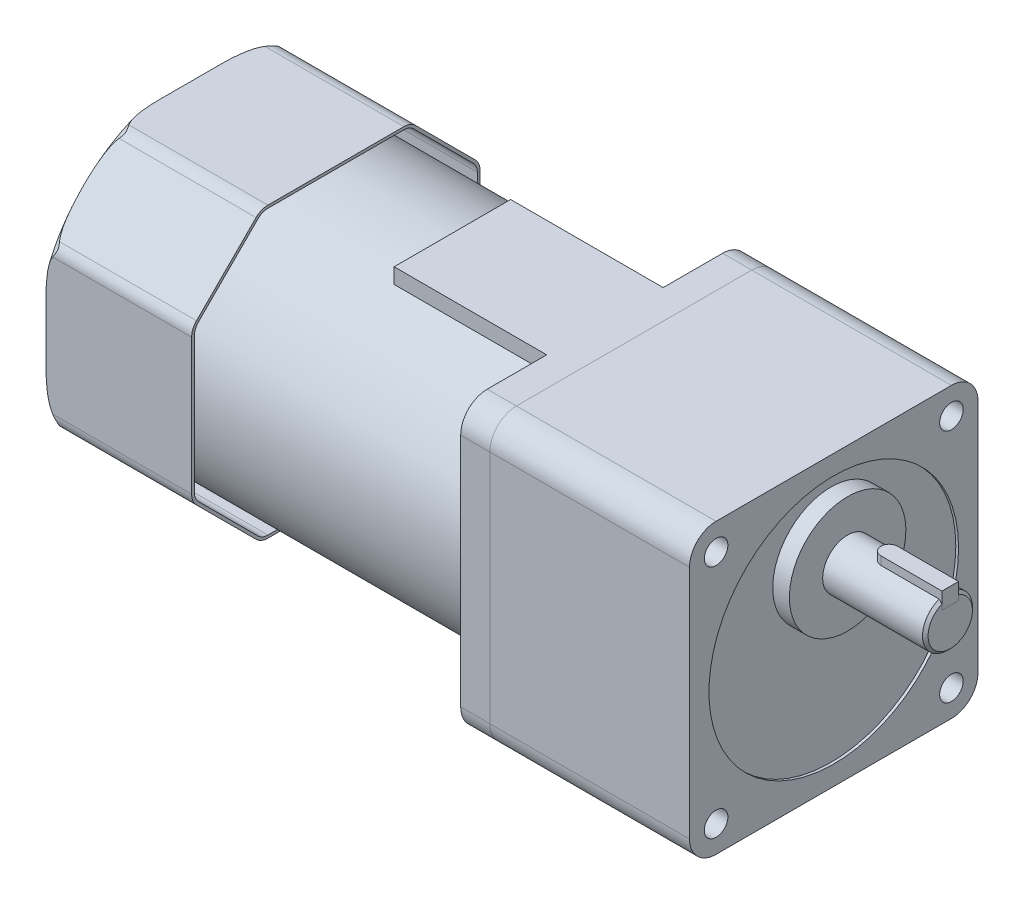
from build123d import *

# Parameters (mm, degrees)
SKETCH1_R                = 4.25
BOSS_EXTRUDE1_DEPTH      = 72
CHAMFER1_SIZE            = 1
BOSS_EXTRUDE2_START      = 31.5
BOSS_EXTRUDE2_DEPTH      = 6
CUT_EXTRUDE1_DEPTH       = 6
CUT_EXTRUDE2_START       = -1
SKETCH5_R                = 45
SKETCH5_R_2              = 21
CUT_EXTRUDE2_DEPTH       = 1
SKETCH6_R                = 4.25
BOSS_EXTRUDE3_DEPTH      = 10.5
BOSS_EXTRUDE4_DEPTH      = 2
BOSS_EXTRUDE4_DEPTH_BACK = 50.5
SHELL1_T                 = -1
SKETCH10_W               = 55
SKETCH10_H               = 42
BOSS_EXTRUDE5_DEPTH      = 11


with BuildPart() as part:
    # Sketch1 → Boss-Extrude1 (new body)
    with BuildSketch(Plane(origin=(0, 0, 0), x_dir=(0, 0, -1), z_dir=(1, 0, 0))):
        with BuildLine():
            Line((-42.426, -52), (42.426, -52))
            ThreePointArc((42.426, -52), (49.195840323, -49.195840323), (52, -42.426))
            Line((52, -42.426), (52, 42.426))
            ThreePointArc((52, 42.426), (49.195840323, 49.195840323), (42.426, 52))
            Line((42.426, 52), (-42.426, 52))
            ThreePointArc((-42.426, 52), (-49.195840323, 49.195840323), (-52, 42.426))
            Line((-52, 42.426), (-52, -42.426))
            ThreePointArc((-52, -42.426), (-49.195840323, -49.195840323), (-42.426, -52))
        make_face()
        with Locations((-42.426406871, -42.426406871)):
            Circle(SKETCH1_R, mode=Mode.SUBTRACT)
        with Locations((-42.426406871, 42.426406871)):
            Circle(SKETCH1_R, mode=Mode.SUBTRACT)
        with Locations((42.426406871, 42.426406871)):
            Circle(SKETCH1_R, mode=Mode.SUBTRACT)
        with Locations((42.426406871, -42.426406871)):
            Circle(SKETCH1_R, mode=Mode.SUBTRACT)
    extrude(amount=BOSS_EXTRUDE1_DEPTH)

    # Sketch2 → Revolve1 (revolve)
    with BuildSketch(Plane.XY):
        Polygon((114, 20), (114, 29), (77, 29), (77, 41), (72, 41), (72, 20), align=None)
    revolve(axis=Axis((72, 20, 0), (1, 0, 0)))

    # Chamfer1
    chamfer1_edges = [part.edges().sort_by_distance(p)[0] for p in [
        (114, 11, 0),
    ]]
    chamfer(chamfer1_edges, length=CHAMFER1_SIZE)

    # Sketch4 → Cut-Extrude1 (cut)
    with BuildSketch(Plane(origin=(0, 31.5, 0), x_dir=(1, 0, 0), z_dir=(0, 1, 0))):
        with BuildLine():
            Line((114, -3), (114, 3))
            Line((114, 3), (92, 3))
            ThreePointArc((92, 3), (89, 0), (92, -3))
            Line((92, -3), (114, -3))
        make_face()
    extrude(amount=-CUT_EXTRUDE1_DEPTH, mode=Mode.SUBTRACT)

    # Sketch5 → Cut-Extrude2 (cut)
    with BuildSketch(Plane(origin=(72, 0, 0), x_dir=(0, 0, -1), z_dir=(1, 0, 0)).offset(CUT_EXTRUDE2_START)):
        Circle(SKETCH5_R)
        with Locations((0, 20)):
            Circle(SKETCH5_R_2, mode=Mode.SUBTRACT)
    extrude(amount=CUT_EXTRUDE2_DEPTH, mode=Mode.SUBTRACT)


with BuildPart() as body_2:
    # Sketch3 → Boss-Extrude2 (new body)
    with BuildSketch(Plane(origin=(0, 0, 0), x_dir=(1, 0, 0), z_dir=(0, 1, 0)).offset(BOSS_EXTRUDE2_START)):
        with BuildLine():
            Line((114, 3), (92, 3))
            ThreePointArc((92, 3), (89, 0), (92, -3))
            Line((92, -3), (114, -3))
            Line((114, -3), (114, 3))
        make_face()
    extrude(amount=-BOSS_EXTRUDE2_DEPTH)


with BuildPart() as body_3:
    # Sketch6 → Boss-Extrude3 (new body)
    with BuildSketch(Plane.ZY):
        with BuildLine():
            Line((52, -42.426), (52, 42.426))
            ThreePointArc((52, 42.426), (49.195840323, 49.195840323), (42.426, 52))
            Line((42.426, 52), (-42.426, 52))
            ThreePointArc((-42.426, 52), (-49.195840323, 49.195840323), (-52, 42.426))
            Line((-52, 42.426), (-52, -42.426))
            ThreePointArc((-52, -42.426), (-49.195840323, -49.195840323), (-42.426, -52))
            Line((-42.426, -52), (42.426, -52))
            ThreePointArc((42.426, -52), (49.195840323, -49.195840323), (52, -42.426))
        make_face()
        with Locations((42.426406871, 42.426406871)):
            Circle(SKETCH6_R, mode=Mode.SUBTRACT)
        with Locations((-42.426406871, 42.426406871)):
            Circle(SKETCH6_R, mode=Mode.SUBTRACT)
        with Locations((-42.426406871, -42.426406871)):
            Circle(SKETCH6_R, mode=Mode.SUBTRACT)
        with Locations((42.426406871, -42.426406871)):
            Circle(SKETCH6_R, mode=Mode.SUBTRACT)
    extrude(amount=BOSS_EXTRUDE3_DEPTH)

    # Sketch7 → Revolve2 (revolve)
    with BuildSketch(Plane.XY):
        with BuildLine():
            Line((-158, 0), (-158, 44))
            ThreePointArc((-158, 44), (-156.535533906, 47.535533906), (-153, 49))
            Line((-153, 49), (-148.5, 49))
            Line((-148.5, 49), (-148.5, 51))
            Line((-148.5, 51), (-10.5, 51))
            Line((-10.5, 51), (-10.5, 0))
            Line((-10.5, 0), (-158, 0))
        make_face()
    revolve(axis=Axis((-10.5, 0, 0), (-1, 0, 0)))

    # Sketch10 → Boss-Extrude5 (add)
    with BuildSketch(Plane(origin=(0, 52, 0), x_dir=(1, 0, 0), z_dir=(0, 1, 0))):
        with Locations((-38, 0)):
            Rectangle(SKETCH10_W, SKETCH10_H)
    extrude(amount=-BOSS_EXTRUDE5_DEPTH)


with BuildPart() as body_4:
    # Sketch8 → Boss-Extrude4 (new, two sides: drawn at the far end of the back side and taken through both)
    with BuildSketch(Plane.ZY.offset(158).offset(-BOSS_EXTRUDE4_DEPTH_BACK)):
        with BuildLine():
            Line((28.757359313, 50.242640687), (50.242640687, 28.757359313))
            ThreePointArc((50.242640687, 28.757359313), (51.543277195, 26.81081922), (52, 24.514718626))
            Line((52, 24.514718626), (52, -24.514718626))
            ThreePointArc((52, -24.514718626), (51.543277195, -26.81081922), (50.242640687, -28.757359313))
            Line((50.242640687, -28.757359313), (28.757359313, -50.242640687))
            ThreePointArc((28.757359313, -50.242640687), (26.81081922, -51.543277195), (24.514718626, -52))
            Line((24.514718626, -52), (-24.514718626, -52))
            ThreePointArc((-24.514718626, -52), (-26.81081922, -51.543277195), (-28.757359313, -50.242640687))
            Line((-28.757359313, -50.242640687), (-50.242640687, -28.757359313))
            ThreePointArc((-50.242640687, -28.757359313), (-51.543277195, -26.81081922), (-52, -24.514718626))
            Line((-52, -24.514718626), (-52, 24.514718626))
            ThreePointArc((-52, 24.514718626), (-51.543277195, 26.81081922), (-50.242640687, 28.757359313))
            Line((-50.242640687, 28.757359313), (-28.757359313, 50.242640687))
            ThreePointArc((-28.757359313, 50.242640687), (-26.81081922, 51.543277195), (-24.514718626, 52))
            Line((-24.514718626, 52), (24.514718626, 52))
            ThreePointArc((24.514718626, 52), (26.81081922, 51.543277195), (28.757359313, 50.242640687))
        make_face()
    extrude(amount=BOSS_EXTRUDE4_DEPTH + BOSS_EXTRUDE4_DEPTH_BACK)

    # Sketch9 → Cut-Revolve1 (revolve, cut)
    with BuildSketch(Plane.XY):
        with BuildLine():
            Line((-160, 53), (-160, 58.403446364))
            Line((-160, 58.403446364), (-154.596553636, 58.403446364))
            ThreePointArc((-154.596553636, 58.403446364), (-158.417367202, 56.820813566), (-160, 53))
        make_face()
    revolve(axis=Axis((0, 0, 0), (-1, 0, 0)), mode=Mode.SUBTRACT)

    # Shell1
    shell1_openings = [body_4.faces().sort_by_distance(p)[0] for p in [
        (-107.5, 0, 0),
    ]]
    offset(amount=SHELL1_T, openings=shell1_openings)


solid = Compound([part.part, body_2.part, body_3.part, body_4.part])
